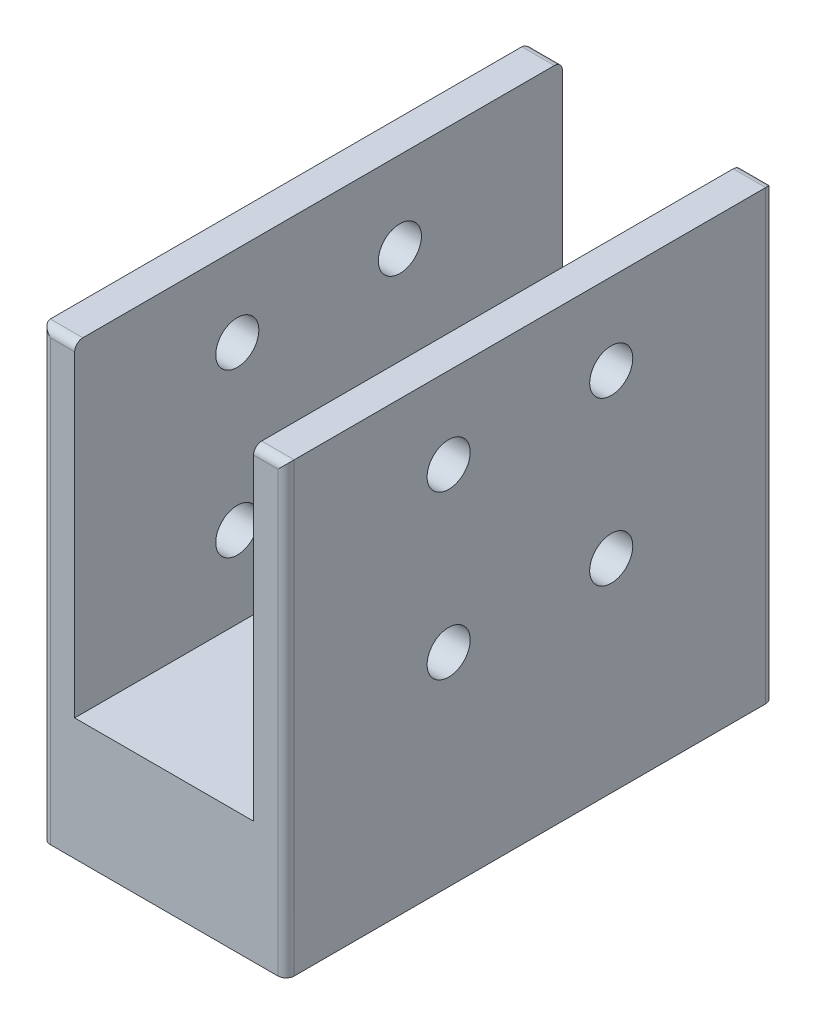
from build123d import *

# Parameters (mm, degrees)
SKETCH1_W            = 30
SKETCH1_H            = 60
SKETCH1_R            = 2.5
BOSS_EXTRUDE1_DEPTH  = 15
SKETCH1_3_W          = 4
SKETCH1_3_H          = 60
BOSS_EXTRUDE2_DEPTH  = 40
M5_CLEARANCE_HOLE1_D = 5.3
LPATTERN1_COUNT      = 2
LPATTERN1_PITCH      = 20
FILLET1_R            = 1


with BuildPart() as part:
    # Sketch1 → Boss-Extrude1 (new body)
    with BuildSketch(Plane(origin=(0, 0, 0), x_dir=(1, 0, 0), z_dir=(0, 1, 0))):
        Rectangle(SKETCH1_W, SKETCH1_H)
        with Locations((0, 10)):
            Circle(SKETCH1_R, mode=Mode.SUBTRACT)
        with Locations((0, -10)):
            Circle(SKETCH1_R, mode=Mode.SUBTRACT)
    extrude(amount=-BOSS_EXTRUDE1_DEPTH)

    # Sketch1<3> → Boss-Extrude2 (add)
    with BuildSketch(Plane(origin=(0, 0, 0), x_dir=(1, 0, 0), z_dir=(0, 1, 0))):
        with Locations((-13, 0)):
            Rectangle(SKETCH1_3_W, SKETCH1_3_H)
        with Locations((13, 0)):
            Rectangle(SKETCH1_3_W, SKETCH1_3_H)
    extrude(amount=BOSS_EXTRUDE2_DEPTH)

    # M5 Clearance Hole1 (through all)
    with Locations(Plane(origin=(15, 10, 10), x_dir=(0, 0, 1), z_dir=(1, 0, 0))):
        with Locations((0, 0), (-20, 0)):
            m5_clearance_hole1 = Hole(M5_CLEARANCE_HOLE1_D / 2)

    # LPattern1: M5 Clearance Hole1 ×2
    with Locations(*[(0, i * LPATTERN1_PITCH, 0) for i in range(1, LPATTERN1_COUNT)]):
        add(m5_clearance_hole1, mode=Mode.SUBTRACT)

    # Fillet1
    fillet1_edges = [part.edges().sort_by_distance(p)[0] for p in [
        (-15, 12.5, -30),
        (15, 12.5, -30),
        (15, 12.5, 30),
        (-15, 12.5, 30),
        (13, 40, 30),
        (13, 40, -30),
        (-13, 40, -30),
        (-13, 40, 30),
    ]]
    fillet(fillet1_edges, radius=FILLET1_R)


solid = part.part
